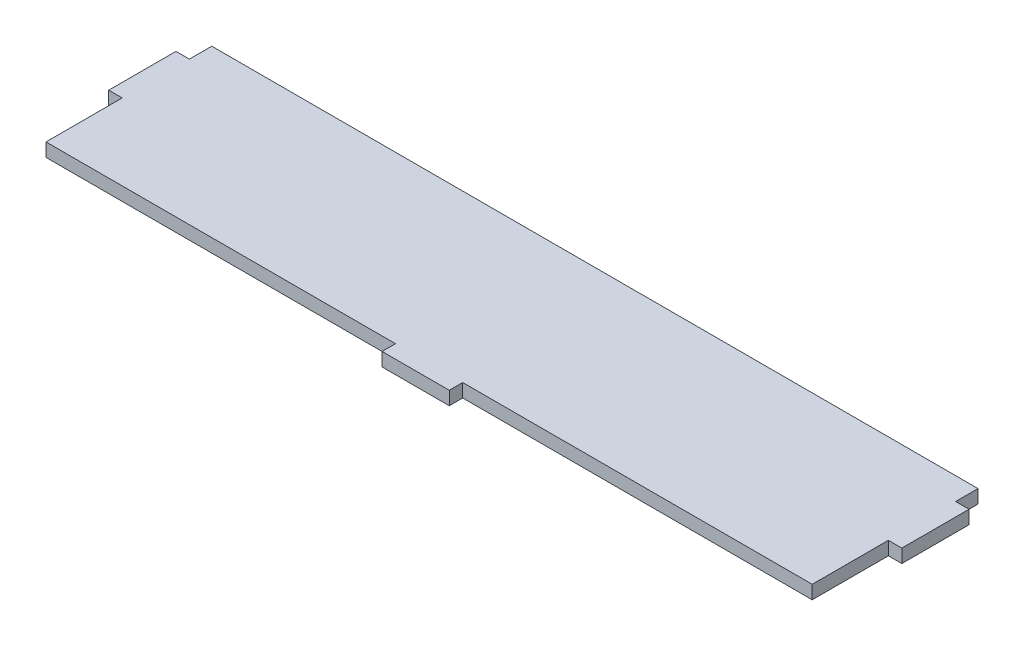
from build123d import *

# Parameters (mm, degrees)
EXTRUDE_1_DEPTH = 3


with BuildPart() as part:
    # 草图1 → 凸台-拉伸1 (new body)
    with BuildSketch(Plane(origin=(0, 0, 0), x_dir=(1, 0, 0), z_dir=(0, 1, 0))):
        Polygon((-88.5, 0), (-85.5, 0), (-85.5, -17), (-7.5, -17), (-7.5, -20), (7.5, -20), (7.5, -17), (85.5, -17), (85.5, 0), (88.5, 0), (88.5, 15), (85.5, 15), (85.5, 20), (-85.5, 20), (-85.5, 15), (-88.5, 15), align=None)
    extrude(amount=EXTRUDE_1_DEPTH)


solid = part.part
